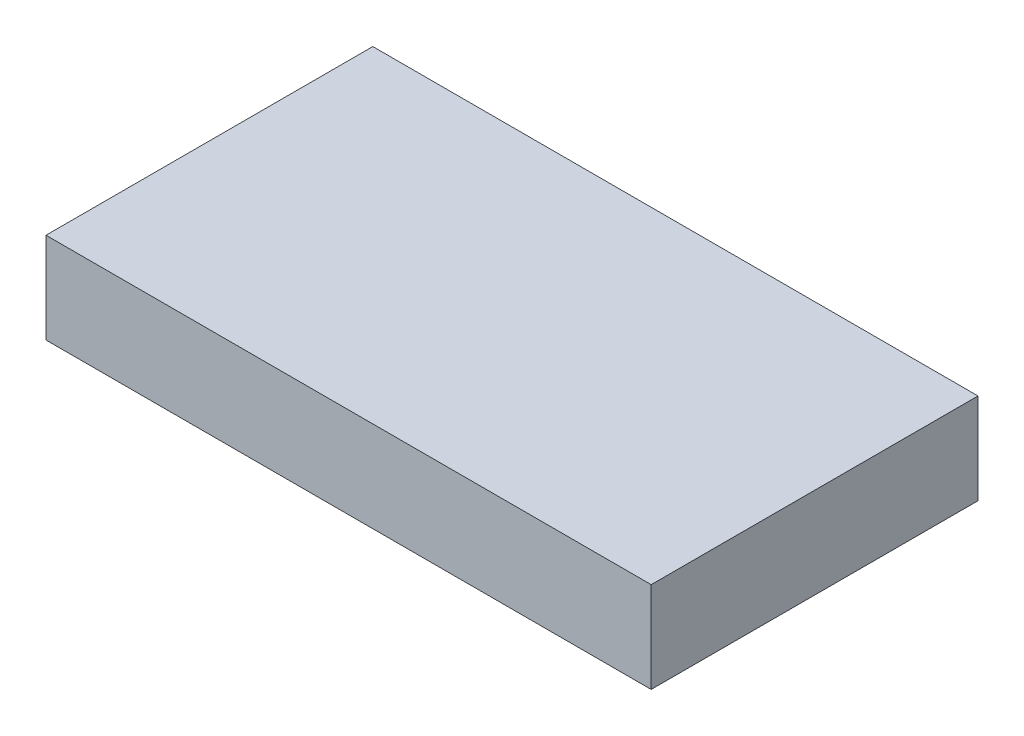
from build123d import *

# Parameters (mm, degrees)
SKETCH1_W           = 127
SKETCH1_H           = 68.58
BOSS_EXTRUDE1_DEPTH = 19.05


with BuildPart() as part:
    # Sketch1 → Boss-Extrude1 (new body)
    with BuildSketch(Plane(origin=(0, 0, 0), x_dir=(1, 0, 0), z_dir=(0, 1, 0))):
        with Locations((-88.787460027, 28.704468353)):
            Rectangle(SKETCH1_W, SKETCH1_H)
    extrude(amount=BOSS_EXTRUDE1_DEPTH)


solid = part.part
